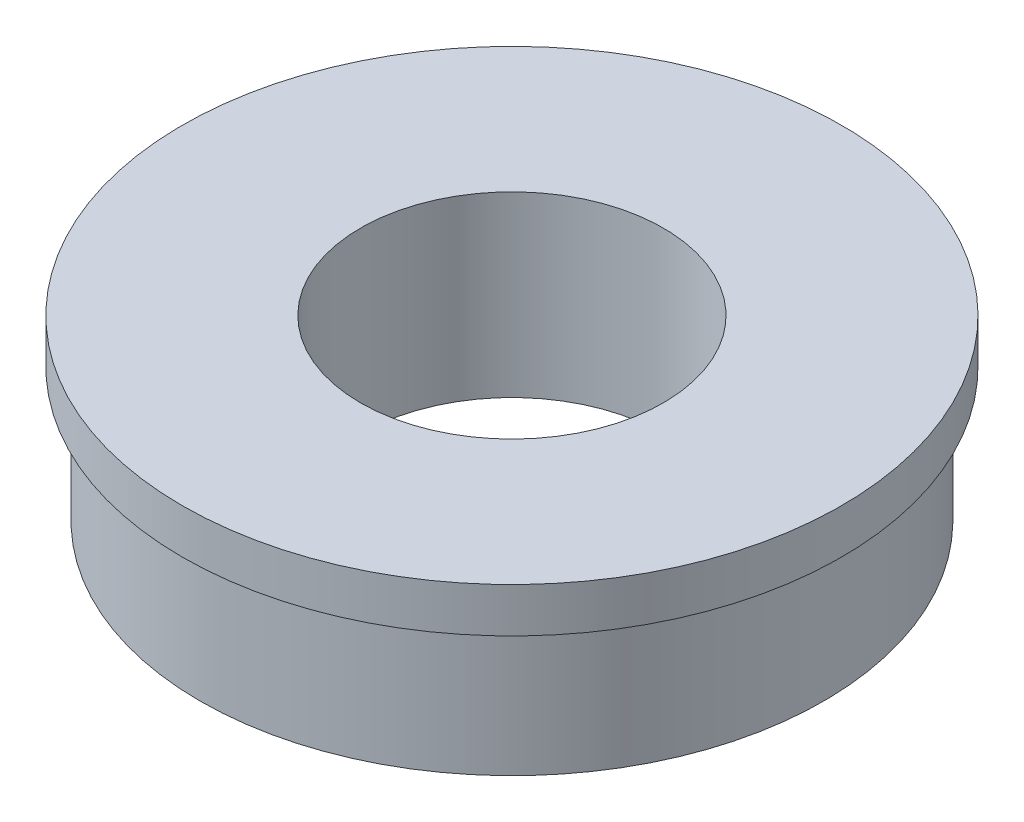
from build123d import *


with BuildPart() as part:
    # Sketch1 → Revolve1 (revolve)
    with BuildSketch(Plane.XY, mode=Mode.PRIVATE) as revolve1_sk:
        Polygon((8.5, 0), (18.5, 0), (18.5, -2.5), (17.5, -2.5), (17.5, -10), (8.5, -10), align=None)
    revolve(revolve1_sk.sketch.rotate(Axis((0, 8.564883574, 0), (0, -1, 0)), 90), axis=Axis((0, 8.564883574, 0), (0, -1, 0)))


solid = part.part
